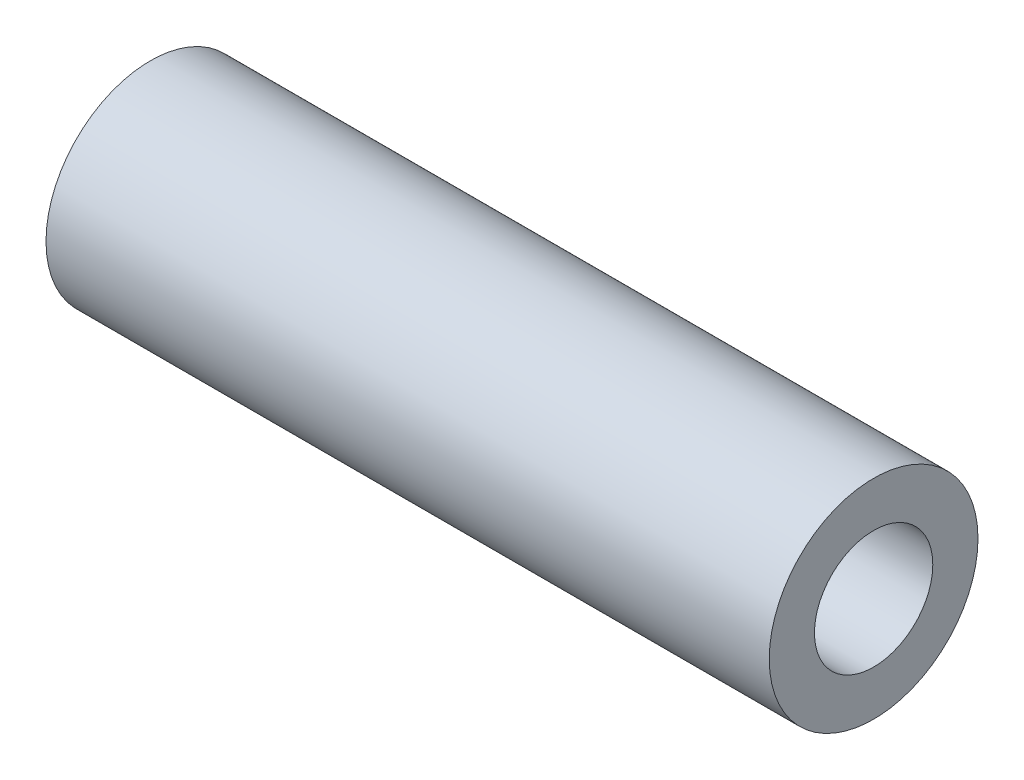
from build123d import *

# Parameters (mm, degrees)
SKETCH1_R           = 3.175
SKETCH1_R_2         = 1.8
BOSS_EXTRUDE1_DEPTH = 22


with BuildPart() as part:
    # Sketch1 → Boss-Extrude1 (new body)
    with BuildSketch(Plane(origin=(0, 0, 0), x_dir=(0, 0, -1), z_dir=(1, 0, 0))):
        Circle(SKETCH1_R)
        Circle(SKETCH1_R_2, mode=Mode.SUBTRACT)
    extrude(amount=BOSS_EXTRUDE1_DEPTH)


solid = part.part
